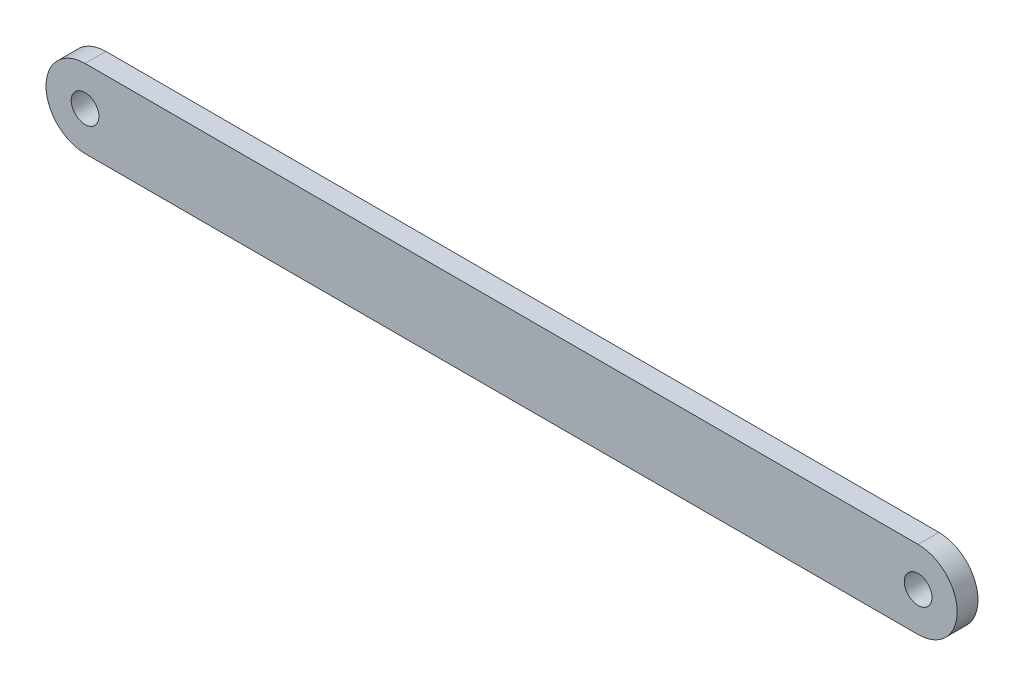
from build123d import *

# Parameters (mm, degrees)
SKETCH1_R           = 3.3782
BOSS_EXTRUDE1_DEPTH = 5.08


with BuildPart() as part:
    # Sketch1 → Boss-Extrude1 (new body)
    with BuildSketch(Plane.XY):
        with BuildLine():
            Line((-101.6, 9.525), (101.6, 9.525))
            ThreePointArc((101.6, 9.525), (111.125, 0), (101.6, -9.525))
            Line((101.6, -9.525), (-101.6, -9.525))
            ThreePointArc((-101.6, -9.525), (-111.125, 0), (-101.6, 9.525))
        make_face()
        with Locations((-101.6, 0)):
            Circle(SKETCH1_R, mode=Mode.SUBTRACT)
        with Locations((101.6, 0)):
            Circle(SKETCH1_R, mode=Mode.SUBTRACT)
    extrude(amount=BOSS_EXTRUDE1_DEPTH)


solid = part.part
